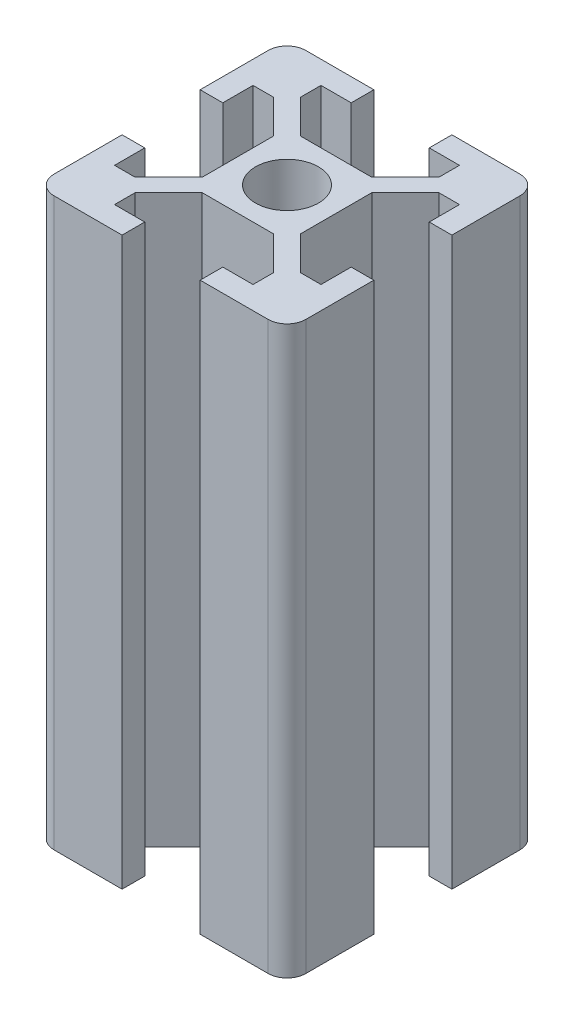
from build123d import *

# Parameters (mm, degrees)
DODANIE_WYCI_GNI_CIE1_DEPTH = 45


with BuildPart() as part:
    # Szkic1 → Dodanie-wyciągnięcie1 (new body)
    with BuildSketch(Plane(origin=(0, 0, 0), x_dir=(1, 0, 0), z_dir=(0, 1, 0))):
        with BuildLine():
            Line((0, 3.9), (2.839339828, 3.9))
            Line((2.839339828, 3.9), (5.5, 6.560660172))
            Line((5.5, 6.560660172), (5.5, 8.2))
            Line((5.5, 8.2), (3.1, 8.2))
            Line((3.1, 8.2), (3.1, 10))
            Line((3.1, 10), (8.5, 10))
            ThreePointArc((8.5, 10), (9.560660172, 9.560660172), (10, 8.5))
            Line((10, 8.5), (10, 3.1))
            Line((10, 3.1), (8.2, 3.1))
            Line((8.2, 3.1), (8.2, 5.5))
            Line((8.2, 5.5), (6.560660172, 5.5))
            Line((6.560660172, 5.5), (3.9, 2.839339828))
            Line((3.9, 2.839339828), (3.9, 0))
            Line((3.9, 0), (3.9, -2.839339828))
            Line((3.9, -2.839339828), (6.560660172, -5.5))
            Line((6.560660172, -5.5), (8.2, -5.5))
            Line((8.2, -5.5), (8.2, -3.1))
            Line((8.2, -3.1), (10, -3.1))
            Line((10, -3.1), (10, -8.5))
            ThreePointArc((10, -8.5), (9.560660172, -9.560660172), (8.5, -10))
            Line((8.5, -10), (3.1, -10))
            Line((3.1, -10), (3.1, -8.2))
            Line((3.1, -8.2), (5.5, -8.2))
            Line((5.5, -8.2), (5.5, -6.560660172))
            Line((5.5, -6.560660172), (2.839339828, -3.9))
            Line((2.839339828, -3.9), (0, -3.9))
            Line((0, -3.9), (-2.839339828, -3.9))
            Line((-2.839339828, -3.9), (-5.5, -6.560660172))
            Line((-5.5, -6.560660172), (-5.5, -8.2))
            Line((-5.5, -8.2), (-3.1, -8.2))
            Line((-3.1, -8.2), (-3.1, -10))
            Line((-3.1, -10), (-8.5, -10))
            ThreePointArc((-8.5, -10), (-9.560660172, -9.560660172), (-10, -8.5))
            Line((-10, -8.5), (-10, -3.1))
            Line((-10, -3.1), (-8.2, -3.1))
            Line((-8.2, -3.1), (-8.2, -5.5))
            Line((-8.2, -5.5), (-6.560660172, -5.5))
            Line((-6.560660172, -5.5), (-3.9, -2.839339828))
            Line((-3.9, -2.839339828), (-3.9, 0))
            Line((-3.9, 0), (-3.9, 2.839339828))
            Line((-3.9, 2.839339828), (-6.560660172, 5.5))
            Line((-6.560660172, 5.5), (-8.2, 5.5))
            Line((-8.2, 5.5), (-8.2, 3.1))
            Line((-8.2, 3.1), (-10, 3.1))
            Line((-10, 3.1), (-10, 8.5))
            ThreePointArc((-10, 8.5), (-9.560660172, 9.560660172), (-8.5, 10))
            Line((-8.5, 10), (-3.1, 10))
            Line((-3.1, 10), (-3.1, 8.2))
            Line((-3.1, 8.2), (-5.5, 8.2))
            Line((-5.5, 8.2), (-5.5, 6.560660172))
            Line((-5.5, 6.560660172), (-2.839339828, 3.9))
            Line((-2.839339828, 3.9), (0, 3.9))
        make_face()
        with BuildLine():
            ThreePointArc((2.5, 0), (1.767766953, 1.767766953), (0, 2.5))
            ThreePointArc((0, 2.5), (-1.767766953, 1.767766953), (-2.5, 0))
            ThreePointArc((-2.5, 0), (-1.767766953, -1.767766953), (0, -2.5))
            ThreePointArc((0, -2.5), (1.767766953, -1.767766953), (2.5, 0))
        make_face(mode=Mode.SUBTRACT)
    extrude(amount=DODANIE_WYCI_GNI_CIE1_DEPTH)


solid = part.part
